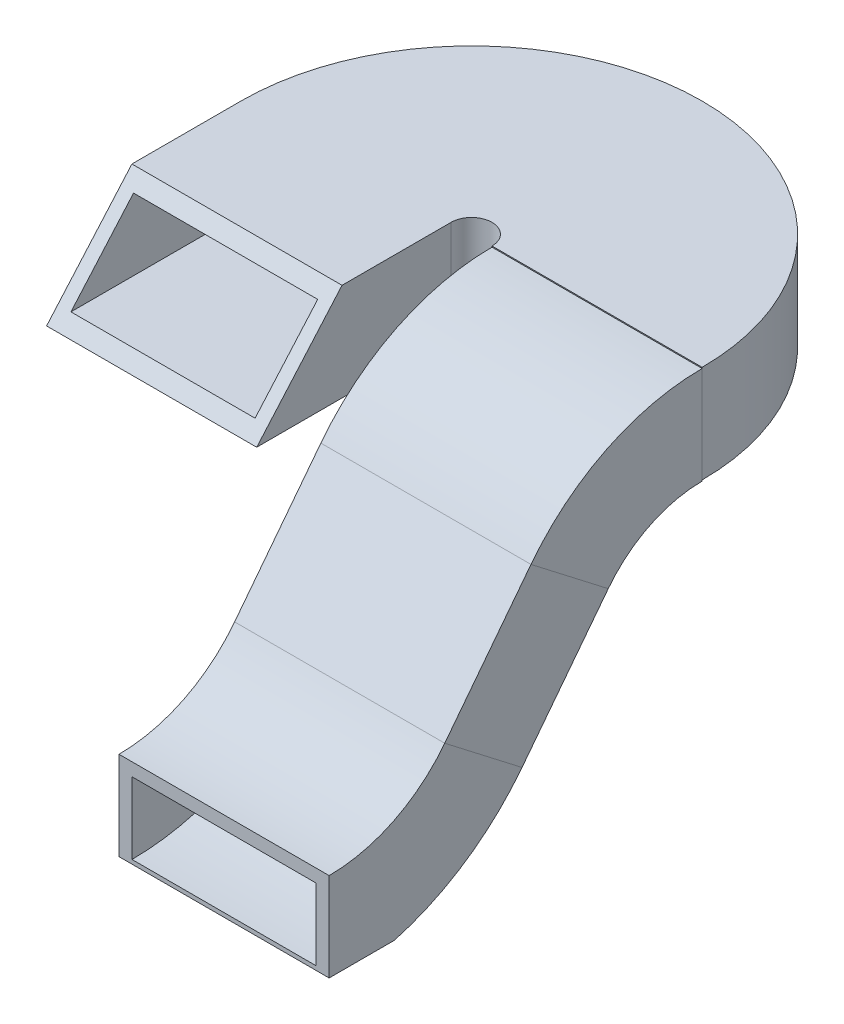
from build123d import *

# Parameters (mm, degrees)
SKETCH4_W                = 47.7
SKETCH4_H                = 102.7
SKETCH4_W_2              = 35
SKETCH4_H_2              = 90
REVOLVE2_ANGLE           = 90
REVOLVE2_OTHER_WAY_ANGLE = 90
SKETCH10_W               = 102.7
SKETCH10_H               = 47.7
SKETCH10_W_2             = 90
SKETCH10_H_2             = 35
BOSS_EXTRUDE1_DEPTH      = 95
CUT_EXTRUDE2_DEPTH       = 360.751181374
SKETCH1_W                = 102.7
SKETCH1_H                = 47.7
SKETCH1_W_2              = 90
SKETCH1_H_2              = 35
CUT_EXTRUDE3_DEPTH       = 407.412084589
CUT_EXTRUDE3_DEPTH_BACK  = 407.412084589


with BuildPart() as part:
    # Sketch4 → Revolve2 (revolve)
    with BuildSketch(Plane(origin=(-16.35, 0, 0), x_dir=(0, -1, 0), z_dir=(-1, 0, 0))):
        with Locations((-141.5, -243.65)):
            Rectangle(SKETCH4_W, SKETCH4_H)
        with Locations((-141.5, -243.65)):
            Rectangle(SKETCH4_W_2, SKETCH4_H_2, mode=Mode.SUBTRACT)
    revolve(axis=Axis((-16.35, 289, -182.3), (0, -1, 0)), revolution_arc=REVOLVE2_ANGLE)

    # Sketch4 → Revolve2 other way (revolve)
    with BuildSketch(Plane(origin=(-16.35, 0, 0), x_dir=(0, -1, 0), z_dir=(-1, 0, 0))):
        with Locations((-141.5, -243.65)):
            Rectangle(SKETCH4_W, SKETCH4_H)
        with Locations((-141.5, -243.65)):
            Rectangle(SKETCH4_W_2, SKETCH4_H_2, mode=Mode.SUBTRACT)
    revolve(axis=Axis((-16.35, 289, -182.3), (0, 1, 0)), revolution_arc=REVOLVE2_OTHER_WAY_ANGLE)

    # Sketch10 → Boss-Extrude1 (add)
    with BuildSketch(Plane.XY.offset(-182.3)):
        with Locations((-77.7, 141.5)):
            Rectangle(SKETCH10_W, SKETCH10_H)
        with Locations((-77.7, 141.5)):
            Rectangle(SKETCH10_W_2, SKETCH10_H_2, mode=Mode.SUBTRACT)
    extrude(amount=BOSS_EXTRUDE1_DEPTH)

    # Sketch11 → Cut-Extrude2 (cut, through all)
    with BuildSketch(Plane(origin=(-26.35, 0, 0), x_dir=(0, 0, -1), z_dir=(1, 0, 0))):
        Polygon((87.3, 165.35), (87.3, 117.65), (129, 165.35), align=None)
    extrude(amount=-CUT_EXTRUDE2_DEPTH, mode=Mode.SUBTRACT)

    # Sweep1: sweep along a path in Sketch8
    with BuildLine(Plane(origin=(-6.35, 0, 0), x_dir=(0, -1, 0), z_dir=(-1, 0, 0))) as sweep1_path:
        ThreePointArc((5.835401436, 0), (-6.319346867, -52.292435279), (-40.291475749, -93.863232155))
        Line((-40.291475749, -93.863232155), (-94.90018434, -136.006572847))
        ThreePointArc((-94.90018434, -136.006572847), (-111.65526764, -156.509325764), (-117.65, -182.3))
    # Sketch1 → Sweep1 (sweep)
    with BuildSketch(Plane.XY):
        with Locations((45, 17.5)):
            Rectangle(SKETCH1_W, SKETCH1_H)
        with Locations((45, 17.5)):
            Rectangle(SKETCH1_W_2, SKETCH1_H_2, mode=Mode.SUBTRACT)
    sweep(path=sweep1_path.line)

    # Sketch12 → Cut-Extrude3 (cut, two sides: drawn at the far end of the back side and taken through both)
    with BuildSketch(Plane(origin=(96.35, 0, 0), x_dir=(0, 0, -1), z_dir=(1, 0, 0)).offset(-CUT_EXTRUDE3_DEPTH_BACK)):
        with BuildLine():
            Line((31.891429718, -2), (0, -2))
            Line((0, -2), (0, -6.35))
            ThreePointArc((0, -6.35), (16.093366564, -5.25748827), (31.891429718, -2))
        make_face()
        with BuildLine():
            Line((73.302994761, -2), (31.891429718, -2))
            ThreePointArc((31.891429718, -2), (16.093366564, -5.25748827), (0, -6.35))
            Line((0, -6.35), (73.302994761, -6.35))
            Line((73.302994761, -6.35), (73.302994761, -2))
        make_face()
    extrude(amount=CUT_EXTRUDE3_DEPTH + CUT_EXTRUDE3_DEPTH_BACK, mode=Mode.SUBTRACT)


solid = part.part
